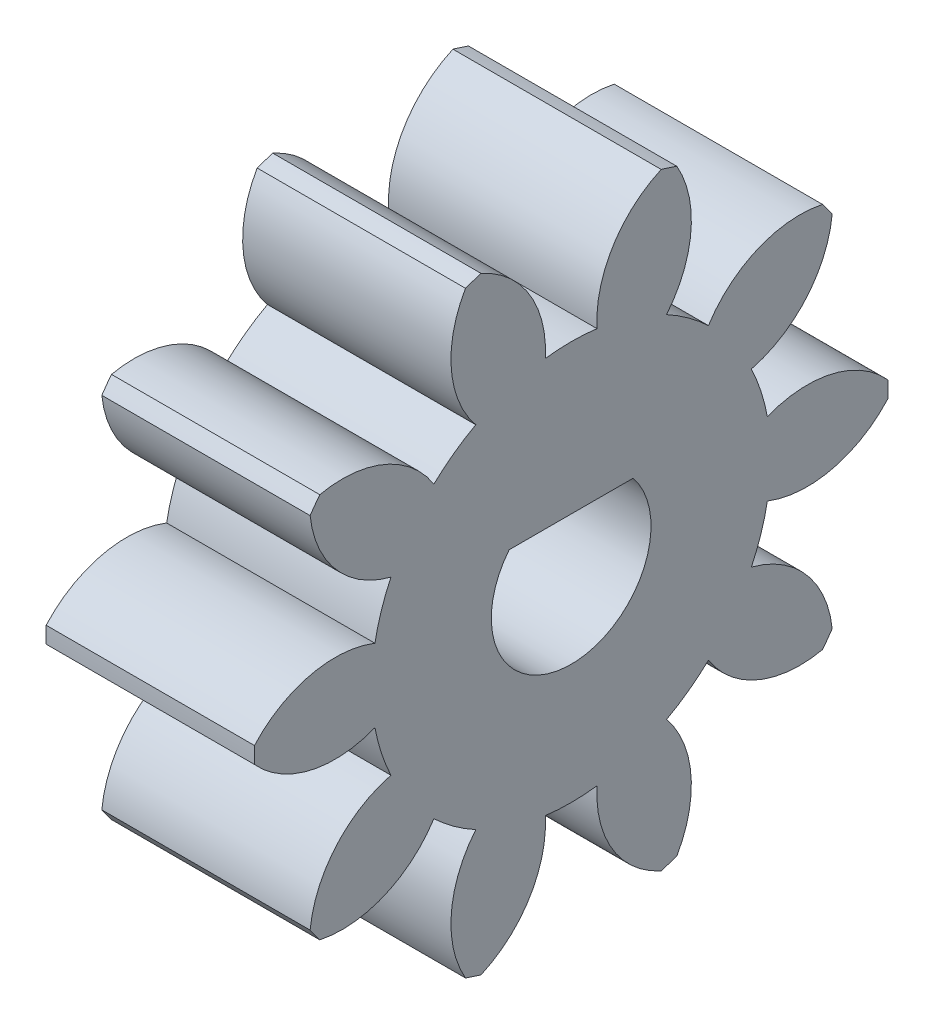
from build123d import *

# Parameters (mm, degrees)
BASPROSKE_W         = 6
BASPROSKE_H         = 9
TOOTHCUT_DEPTH      = 15.071247279
TEETHCUTS_COUNT     = 10
TEETHCUTS_ANGLE     = 324
BORSKE_R            = 2.5
BORE_DEPTH          = 50.0000508
BOSS_EXTRUDE2_DEPTH = 6


with BuildPart() as part:
    # BasProSke → Base-Revolve (revolve)
    with BuildSketch(Plane(origin=(0, 0, 0), x_dir=(1, 0, 0), z_dir=(0, 1, 0)), mode=Mode.PRIVATE) as base_revolve_sk:
        with Locations((3, 4.5)):
            Rectangle(BASPROSKE_W, BASPROSKE_H)
    revolve(base_revolve_sk.sketch.rotate(Axis((-10, 0, 0), (1, 0, 0)), 180), axis=Axis((-10, 0, 0), (1, 0, 0)))

    # TooCutSke → ToothCut (cut, through all)
    with BuildSketch(Plane(origin=(0, 0, 0), x_dir=(0, 0, -1), z_dir=(1, 0, 0))):
        with BuildLine():
            ThreePointArc((0.883878355, 5.554109745), (0, 5.624), (-0.883878355, 5.554109745))
            ThreePointArc((-0.883878355, 5.554109745), (-1.258245767, 7.379188248), (-2.637816971, 8.631324741))
            ThreePointArc((-2.637816971, 8.631324741), (0, 9.0254), (2.637816971, 8.631324741))
            ThreePointArc((2.637816971, 8.631324741), (1.258245767, 7.379188248), (0.883878355, 5.554109745))
        make_face()
    toothcut = extrude(amount=TOOTHCUT_DEPTH, mode=Mode.SUBTRACT)

    # TeethCuts: ToothCut ×10 about axis
    teethcuts_axis = Axis((-10, 0, 0), (1, 0, 0))
    for i in range(1, TEETHCUTS_COUNT):
        add(toothcut.rotate(teethcuts_axis, i * TEETHCUTS_ANGLE / (TEETHCUTS_COUNT - 1)), mode=Mode.SUBTRACT)

    # BorSke → Bore (cut, symmetric)
    with BuildSketch(Plane(origin=(0, 0, 0), x_dir=(0, 0, -1), z_dir=(1, 0, 0))):
        with Locations(Location((0, 0, 0), (0, 0, 180))):
            Circle(BORSKE_R)
    extrude(amount=BORE_DEPTH, both=True, mode=Mode.SUBTRACT)

    # Sketch1 → Boss-Extrude2 (add)
    with BuildSketch(Plane.ZY):
        with BuildLine():
            ThreePointArc((-3.953827157, 4.173517918), (-5.381277451, 5.377958207), (-7.24074087, 5.553133949))
            ThreePointArc((-7.24074087, 5.553133949), (-7.382280074, 5.363540427), (-7.518856208, 5.170341025))
            ThreePointArc((-7.518856208, 5.170341025), (-6.777648381, 3.456018504), (-5.191051196, 2.470625119))
            ThreePointArc((-5.191051196, 2.470625119), (-5.467623912, 1.776538701), (-5.651845645, 1.052445629))
            ThreePointArc((-5.651845645, 1.052445629), (-7.51462943, 1.18782406), (-9.121932655, 0.236579037))
            ThreePointArc((-9.121932655, 0.236579037), (-9.125, 0), (-9.121932655, -0.236579037))
            ThreePointArc((-9.121932655, -0.236579037), (-7.51462943, -1.18782406), (-5.651845645, -1.052445629))
            ThreePointArc((-5.651845645, -1.052445629), (-5.467623912, -1.776538701), (-5.191051196, -2.470625119))
            ThreePointArc((-5.191051196, -2.470625119), (-6.777648381, -3.456018504), (-7.518856208, -5.170341025))
            ThreePointArc((-7.518856208, -5.170341025), (-7.382280074, -5.363540427), (-7.24074087, -5.553133949))
            ThreePointArc((-7.24074087, -5.553133949), (-5.381277451, -5.377958207), (-3.953827157, -4.173517918))
            ThreePointArc((-3.953827157, -4.173517918), (-3.379177415, -4.651038701), (-2.747451628, -5.050001045))
            ThreePointArc((-2.747451628, -5.050001045), (-3.451836013, -6.779779466), (-3.043832247, -8.60236655))
            ThreePointArc((-3.043832247, -8.60236655), (-2.819780074, -8.678390711), (-2.593832177, -8.748580436))
            ThreePointArc((-2.593832177, -8.748580436), (-1.192460387, -7.513895108), (-0.74558108, -5.700448215))
            ThreePointArc((-0.74558108, -5.700448215), (0, -5.749), (0.74558108, -5.700448215))
            ThreePointArc((0.74558108, -5.700448215), (1.192460387, -7.513895108), (2.593832177, -8.748580436))
            ThreePointArc((2.593832177, -8.748580436), (2.819780074, -8.678390711), (3.043832247, -8.60236655))
            ThreePointArc((3.043832247, -8.60236655), (3.451836013, -6.779779466), (2.747451628, -5.050001045))
            ThreePointArc((2.747451628, -5.050001045), (3.379177415, -4.651038701), (3.953827157, -4.173517918))
            ThreePointArc((3.953827157, -4.173517918), (5.381277451, -5.377958207), (7.24074087, -5.553133949))
            ThreePointArc((7.24074087, -5.553133949), (7.382280074, -5.363540427), (7.518856208, -5.170341025))
            ThreePointArc((7.518856208, -5.170341025), (6.777648381, -3.456018504), (5.191051196, -2.470625119))
            ThreePointArc((5.191051196, -2.470625119), (5.467623912, -1.776538701), (5.651845645, -1.052445629))
            ThreePointArc((5.651845645, -1.052445629), (7.51462943, -1.18782406), (9.121932655, -0.236579037))
            ThreePointArc((9.121932655, -0.236579037), (9.125, 0), (9.121932655, 0.236579037))
            ThreePointArc((9.121932655, 0.236579037), (7.51462943, 1.18782406), (5.651845645, 1.052445629))
            ThreePointArc((5.651845645, 1.052445629), (5.467623912, 1.776538701), (5.191051196, 2.470625119))
            ThreePointArc((5.191051196, 2.470625119), (6.777648381, 3.456018504), (7.518856208, 5.170341025))
            ThreePointArc((7.518856208, 5.170341025), (7.382280074, 5.363540427), (7.24074087, 5.553133949))
            ThreePointArc((7.24074087, 5.553133949), (5.381277451, 5.377958207), (3.953827157, 4.173517918))
            ThreePointArc((3.953827157, 4.173517918), (3.379177415, 4.651038701), (2.747451628, 5.050001045))
            ThreePointArc((2.747451628, 5.050001045), (3.451836013, 6.779779466), (3.043832247, 8.60236655))
            ThreePointArc((3.043832247, 8.60236655), (2.819780074, 8.678390711), (2.593832177, 8.748580436))
            ThreePointArc((2.593832177, 8.748580436), (1.192460387, 7.513895108), (0.74558108, 5.700448215))
            ThreePointArc((0.74558108, 5.700448215), (0, 5.749), (-0.74558108, 5.700448215))
            ThreePointArc((-0.74558108, 5.700448215), (-1.192460387, 7.513895108), (-2.593832177, 8.748580436))
            ThreePointArc((-2.593832177, 8.748580436), (-2.819780074, 8.678390711), (-3.043832247, 8.60236655))
            ThreePointArc((-3.043832247, 8.60236655), (-3.451836013, 6.779779466), (-2.747451628, 5.050001045))
            ThreePointArc((-2.747451628, 5.050001045), (-3.379177415, 4.651038701), (-3.953827157, 4.173517918))
        make_face()
        with BuildLine():
            Line((-1.785357107, 1.45), (1.785357107, 1.45))
            ThreePointArc((1.785357107, 1.45), (0, -2.3), (-1.785357107, 1.45))
        make_face(mode=Mode.SUBTRACT)
    extrude(amount=-BOSS_EXTRUDE2_DEPTH)


solid = part.part
